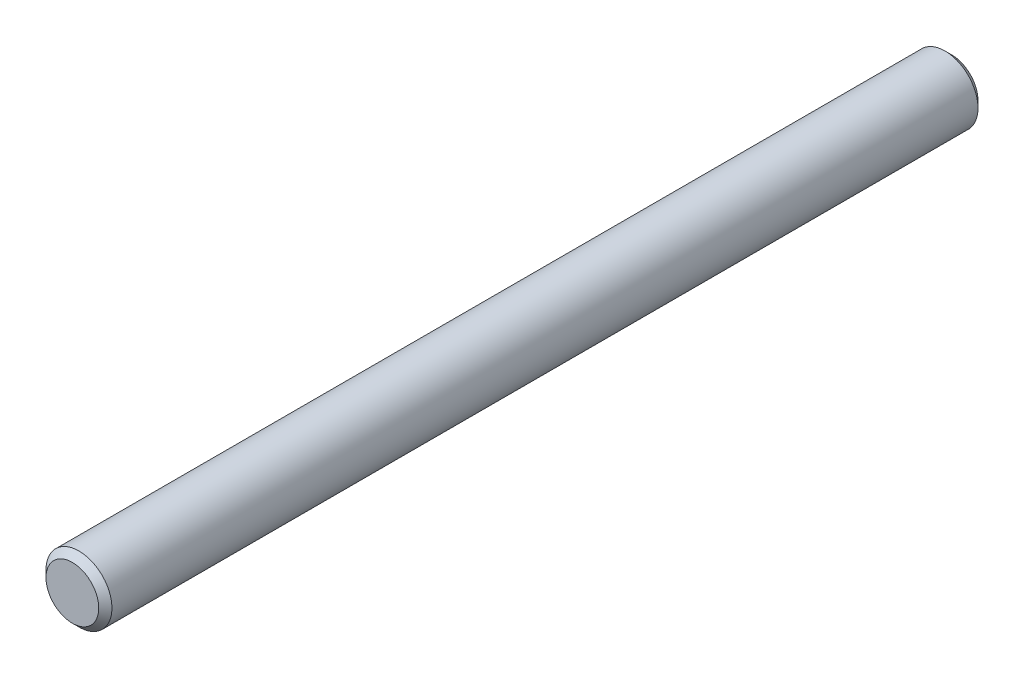
from build123d import *

# Parameters (mm, degrees)
SKETCH3_R           = 4.7625
BOSS_EXTRUDE1_DEPTH = 63.5
CHAMFER1_SIZE       = 0.9525


with BuildPart() as part:
    # Sketch3 → Boss-Extrude1 (new, symmetric)
    with BuildSketch(Plane.XY):
        Circle(SKETCH3_R)
    extrude(amount=BOSS_EXTRUDE1_DEPTH, both=True)

    # Chamfer1
    chamfer1_edges = [part.edges().sort_by_distance(p)[0] for p in [
        (-4.7625, 0, -63.5),
        (-4.7625, 0, 63.5),
    ]]
    chamfer(chamfer1_edges, length=CHAMFER1_SIZE)


solid = part.part
